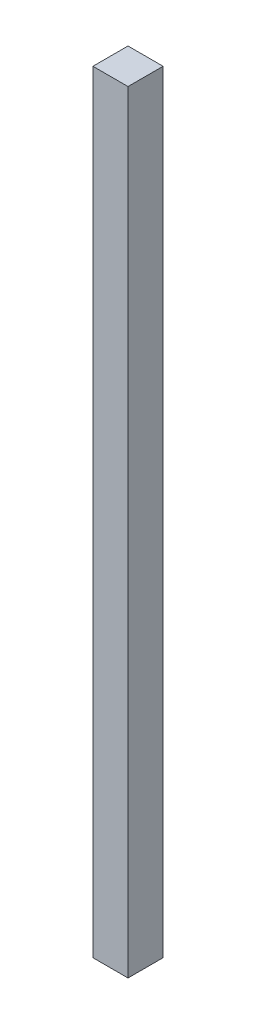
from build123d import *

# Parameters (mm, degrees)
SKETCH1_W           = 25
SKETCH1_H           = 25
BOSS_EXTRUDE1_DEPTH = 550


with BuildPart() as part:
    # Sketch1 → Boss-Extrude1 (new body)
    with BuildSketch(Plane(origin=(0, 0, 0), x_dir=(1, 0, 0), z_dir=(0, 1, 0))):
        with Locations((-12.5, -12.5)):
            Rectangle(SKETCH1_W, SKETCH1_H)
    extrude(amount=BOSS_EXTRUDE1_DEPTH)


solid = part.part
